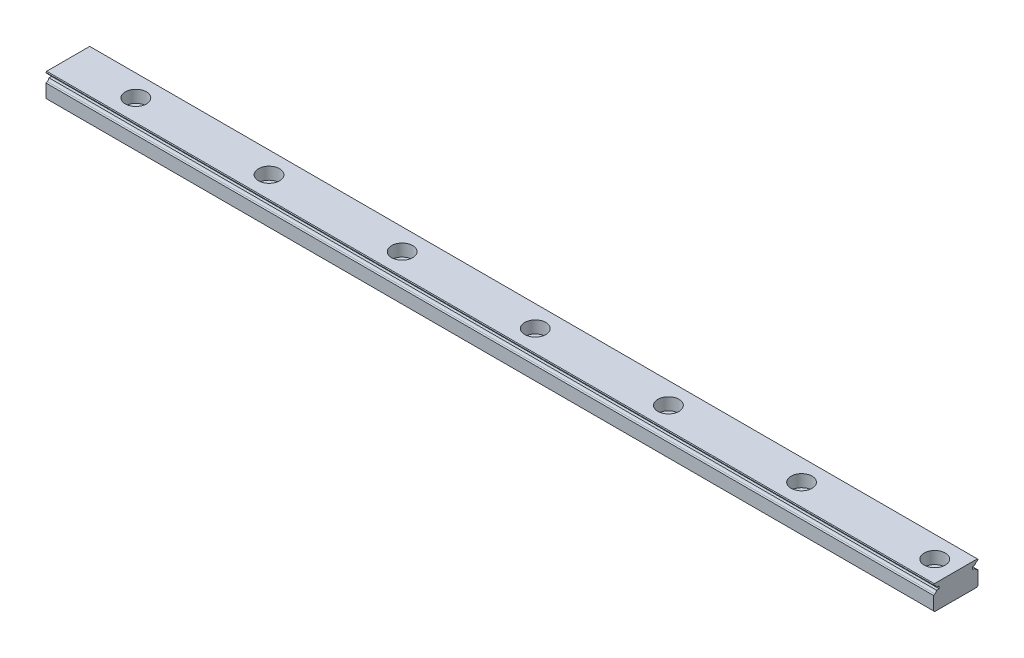
from build123d import *

# Parameters (mm, degrees)
SKETCH1_W                                    = 20
SKETCH1_H                                    = 11
BOSS_EXTRUDE1_DEPTH                          = 400
CUT_EXTRUDE2_DEPTH                           = 401.276154673
CBORE_FOR_SOCKET_HEAD_CAP_SCREW1_D           = 6
CBORE_FOR_SOCKET_HEAD_CAP_SCREW1_CBORE_D     = 9.5
CBORE_FOR_SOCKET_HEAD_CAP_SCREW1_CBORE_DEPTH = 5.5
LPATTERN1_COUNT                              = 7
LPATTERN1_PITCH                              = 60
CHAMFER1_SIZE                                = 0.3
CHAMFER2_SIZE                                = 0.5


with BuildPart() as part:
    # Sketch1 → Boss-Extrude1 (new body)
    with BuildSketch(Plane(origin=(-30.5, 0, 0), x_dir=(0, 0, -1), z_dir=(1, 0, 0))):
        with Locations((0, 5.5)):
            Rectangle(SKETCH1_W, SKETCH1_H)
    extrude(amount=BOSS_EXTRUDE1_DEPTH)

    # Sketch3 → Cut-Extrude2 (cut, through all)
    with BuildSketch(Plane(origin=(-30.5, 0, 0), x_dir=(0, 0, -1), z_dir=(1, 0, 0))):
        with BuildLine():
            Line((10, 10.451039482), (9.455259378, 10.141421591))
            ThreePointArc((9.455259378, 10.141421591), (8.943868436, 9.701092928), (8.637115571, 9.1))
            Line((8.637115571, 9.1), (7.5, 9.1))
            Line((7.5, 9.1), (7.5, 7.9))
            Line((7.5, 7.9), (8.64, 7.9))
            ThreePointArc((8.64, 7.9), (8.939788863, 7.314120259), (9.434780564, 6.880401858))
            Line((9.434780564, 6.880401858), (10, 6.548960518))
            Line((10, 6.548960518), (10, 10.451039482))
        make_face()
        with BuildLine():
            Line((-10, 10.451039482), (-10, 6.548960518))
            Line((-10, 6.548960518), (-9.434780564, 6.880401858))
            ThreePointArc((-9.434780564, 6.880401858), (-8.939788863, 7.314120259), (-8.64, 7.9))
            Line((-8.64, 7.9), (-7.5, 7.9))
            Line((-7.5, 7.9), (-7.5, 9.1))
            Line((-7.5, 9.1), (-8.637115571, 9.1))
            ThreePointArc((-8.637115571, 9.1), (-8.943868436, 9.701092928), (-9.455259378, 10.141421591))
            Line((-9.455259378, 10.141421591), (-10, 10.451039482))
        make_face()
    extrude(amount=CUT_EXTRUDE2_DEPTH, mode=Mode.SUBTRACT)

    # CBORE for Socket Head Cap Screw1 (through all)
    with Locations(Plane(origin=(0, 11, 0), x_dir=(1, 0, 0), z_dir=(0, 1, 0))):
        with Locations((0, 0)):
            cbore_for_socket_head_cap_screw1 = CounterBoreHole(CBORE_FOR_SOCKET_HEAD_CAP_SCREW1_D / 2, CBORE_FOR_SOCKET_HEAD_CAP_SCREW1_CBORE_D / 2, CBORE_FOR_SOCKET_HEAD_CAP_SCREW1_CBORE_DEPTH)

    # LPattern1: CBORE for Socket Head Cap Screw1 ×7
    with Locations(*[(i * LPATTERN1_PITCH, 0, 0) for i in range(1, LPATTERN1_COUNT)]):
        add(cbore_for_socket_head_cap_screw1, mode=Mode.SUBTRACT)

    # Chamfer1
    chamfer1_edges = [part.edges().sort_by_distance(p)[0] for p in [
        (169.5, 11, -10),
        (169.5, 11, 10),
    ]]
    chamfer(chamfer1_edges, length=CHAMFER1_SIZE)

    # Chamfer2
    chamfer2_edges = [part.edges().sort_by_distance(p)[0] for p in [
        (169.5, 0, -10),
        (169.5, 0, 10),
    ]]
    chamfer(chamfer2_edges, length=CHAMFER2_SIZE)


solid = part.part
